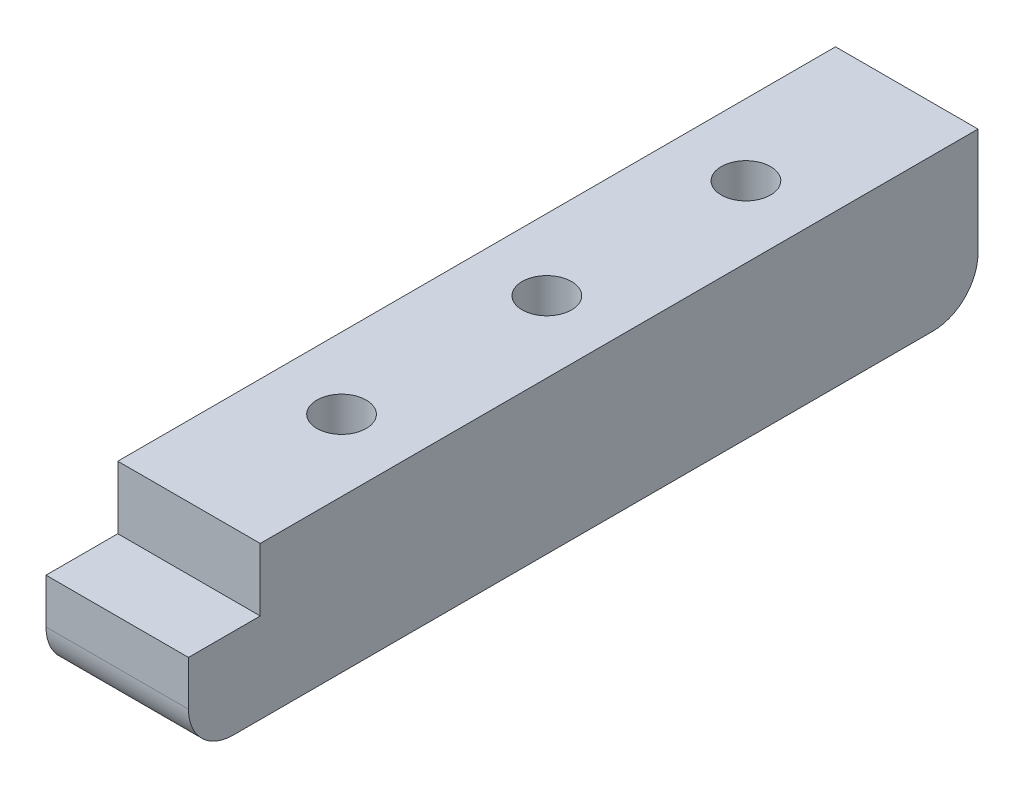
from build123d import *

# Parameters (mm, degrees)
RESSALTO_EXTRUS_O1_DEPTH             = 7.94
FILETE1_R                            = 5
ESCAREADO_PARA_SFHCS_M51_AT_2_COUNT  = 2
ESCAREADO_PARA_SFHCS_M51_AT_2_PITCH  = 45.072604626
ESCAREADO_PARA_SFHCS_M51_AT_3_COUNT  = 2
ESCAREADO_PARA_SFHCS_M51_AT_3_PITCH  = 80.029473244
ESCAREADO_PARA_SFHCS_M51_AT_4_COUNT  = 2
ESCAREADO_PARA_SFHCS_M51_AT_4_PITCH  = 73.938988881
ESCAREADO_PARA_SFHCS_M52_D           = 5.5
ESCAREADO_PARA_SFHCS_M52_CSINK_D     = 11.2
ESCAREADO_PARA_SFHCS_M52_CSINK_ANGLE = 90


with BuildPart() as part:
    # Esboço1 → Ressalto-extrusão1 (new, symmetric)
    with BuildSketch(Plane(origin=(0, 0, 0), x_dir=(0, 0, -1), z_dir=(1, 0, 0))):
        Polygon((-17, -8.5), (63, -8.5), (63, 8.5), (-17, 8.5), (-17, 1.5), (-25, 1.5), (-25, -8.5), align=None)
    extrude(amount=RESSALTO_EXTRUS_O1_DEPTH, both=True)

    # Filete1
    filete1_edges = [part.edges().sort_by_distance(p)[0] for p in [
        (0, -8.5, -63),
        (0, -8.5, 25),
    ]]
    fillet(filete1_edges, radius=FILETE1_R)

    # Esboço3 → Escareado para SFHCS M51 (revolve, cut)
    with BuildSketch(Plane(origin=(0, -8.5, -45.072604626), x_dir=(0, 0, -1), z_dir=(1, 0, 0))):
        Polygon((0, 0), (0, 31.652366702), (2.75, 30), (2.75, 3.35), (5.6, 0.5), (5.6, 0), align=None)
    escareado_para_sfhcs_m51 = revolve(axis=Axis((0, -14.85, -45.072604626), (0, 1, 0)), mode=Mode.SUBTRACT)

    # Escareado para SFHCS M51 at 2: Escareado para SFHCS M51 ×2
    with Locations(*[(0, 0, i * ESCAREADO_PARA_SFHCS_M51_AT_2_PITCH) for i in range(1, ESCAREADO_PARA_SFHCS_M51_AT_2_COUNT)]):
        add(escareado_para_sfhcs_m51, mode=Mode.SUBTRACT)

    # Escareado para SFHCS M51 at 3: Escareado para SFHCS M51 ×2
    with Locations(*[Vector(-0.8263205706487303, 0, 0.563200066160114) * (i * ESCAREADO_PARA_SFHCS_M51_AT_3_PITCH) for i in range(1, ESCAREADO_PARA_SFHCS_M51_AT_3_COUNT)]):
        add(escareado_para_sfhcs_m51, mode=Mode.SUBTRACT)

    # Escareado para SFHCS M51 at 4: Escareado para SFHCS M51 ×2
    with Locations(*[Vector(-0.894386047210078, 0, 0.44729587361827106) * (i * ESCAREADO_PARA_SFHCS_M51_AT_4_PITCH) for i in range(1, ESCAREADO_PARA_SFHCS_M51_AT_4_COUNT)]):
        add(escareado_para_sfhcs_m51, mode=Mode.SUBTRACT)

    # Escareado para SFHCS M52 (through all)
    with Locations(Plane(origin=(0, -8.5, 0), x_dir=(-1, 0, 0), z_dir=(0, -1, 0))):
        with Locations((0, 22.887127338)):
            CounterSinkHole(ESCAREADO_PARA_SFHCS_M52_D / 2, ESCAREADO_PARA_SFHCS_M52_CSINK_D / 2, counter_sink_angle=ESCAREADO_PARA_SFHCS_M52_CSINK_ANGLE)


solid = part.part
